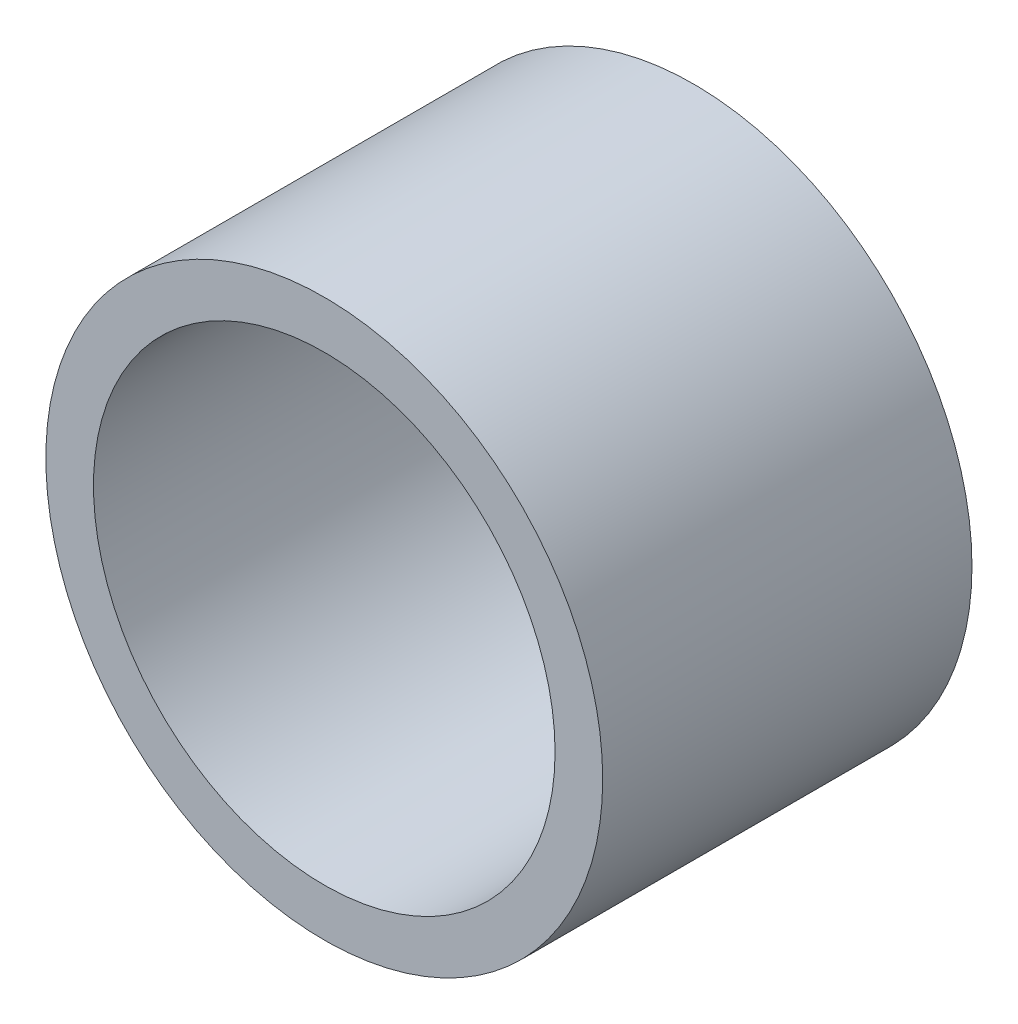
from build123d import *

# Parameters (mm, degrees)
SKETCH1_R      = 4.7879
SKETCH1_R_2    = 3.96875
EXTRUDE1_DEPTH = 3.175


with BuildPart() as part:
    # Sketch1 → Extrude1 (new, symmetric)
    with BuildSketch(Plane.XY):
        Circle(SKETCH1_R)
        Circle(SKETCH1_R_2, mode=Mode.SUBTRACT)
    extrude(amount=EXTRUDE1_DEPTH, both=True)


solid = part.part
